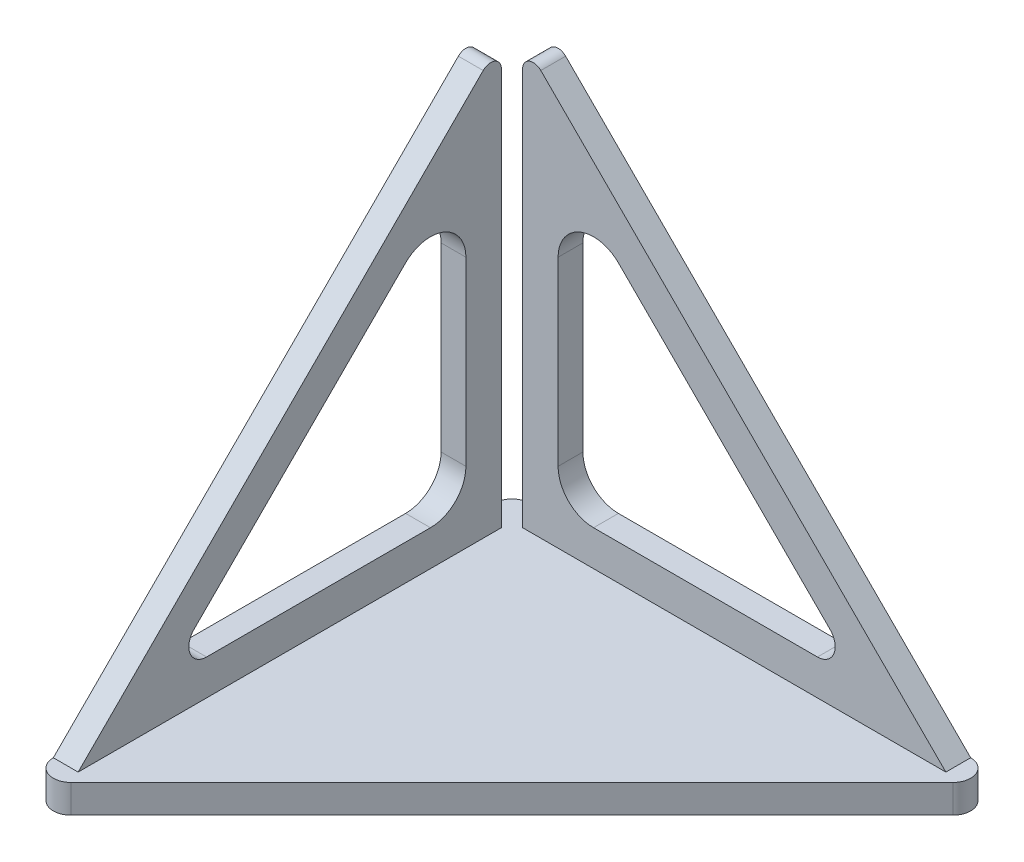
from build123d import *

# Parameters (mm, degrees)
BOSS_EXTRUDE1_DEPTH = 8
EXTRUDE_THIN1_DEPTH = 7
EXTRUDE_THIN2_DEPTH = 7
FILLET1_R           = 10
FILLET2_R           = 5
FILLET3_R           = 3


with BuildPart() as part:
    # Sketch1 → Boss-Extrude1 (new body)
    with BuildSketch(Plane(origin=(0, 0, 0), x_dir=(1, 0, 0), z_dir=(0, 1, 0))):
        with BuildLine():
            Line((8.535533906, -132.885822331), (132.885822331, -8.535533906))
            ThreePointArc((132.885822331, -8.535533906), (133.969686088, -3.086582838), (129.350288425, 0))
            Line((129.350288425, 0), (5, 0))
            ThreePointArc((5, 0), (1.464466094, -1.464466094), (0, -5))
            Line((0, -5), (0, -129.350288425))
            ThreePointArc((0, -129.350288425), (3.086582838, -133.969686088), (8.535533906, -132.885822331))
        make_face()
    extrude(amount=-BOSS_EXTRUDE1_DEPTH)

    # Sketch4 → Extrude-Thin1 (add)
    with BuildSketch(Plane(origin=(0, 0, 0), x_dir=(-1, 0, 0), z_dir=(0, 0, -1))):
        Polygon((-10, 0), (-10, 119.350288425), (-129.350288425, 0), align=None)
        Polygon((-20, 10), (-20, 95.208152802), (-105.208152802, 10), align=None, mode=Mode.SUBTRACT)
    extrude(amount=-EXTRUDE_THIN1_DEPTH)

    # Sketch5 → Extrude-Thin2 (add)
    with BuildSketch(Plane.ZY):
        Polygon((10, 0), (10, 119.350288425), (129.350288425, 0), align=None)
        Polygon((20, 10), (20, 95.208152802), (105.208152802, 10), align=None, mode=Mode.SUBTRACT)
    extrude(amount=-EXTRUDE_THIN2_DEPTH)

    # Fillet1
    fillet1_edges = [part.edges().sort_by_distance(p)[0] for p in [
        (20, 95.208152802, 3.5),
        (20, 10, 3.5),
        (3.5, 95.208152802, 20),
        (3.5, 10, 20),
    ]]
    fillet(fillet1_edges, radius=FILLET1_R)

    # Fillet2
    fillet2_edges = [part.edges().sort_by_distance(p)[0] for p in [
        (105.208152802, 10, 3.5),
        (3.5, 10, 105.208152802),
    ]]
    fillet(fillet2_edges, radius=FILLET2_R)

    # Fillet3
    fillet3_edges = [part.edges().sort_by_distance(p)[0] for p in [
        (10, 119.350288425, 3.5),
        (3.5, 119.350288425, 10),
    ]]
    fillet(fillet3_edges, radius=FILLET3_R)


solid = part.part
